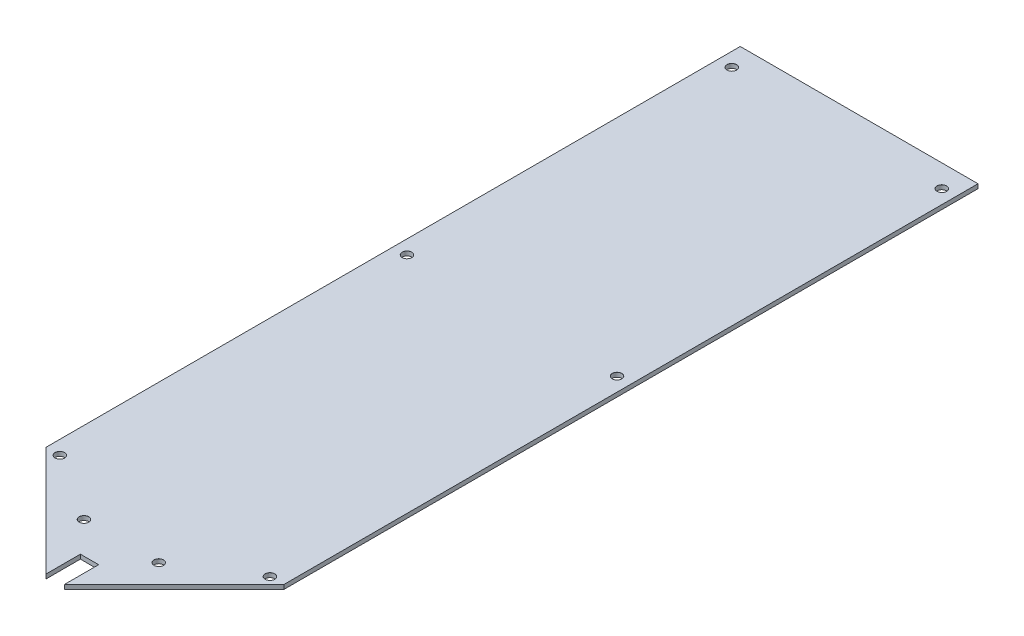
from build123d import *

# Parameters (mm, degrees)
BOSS_EXTRUDE1_DEPTH            = 3
M6_CLEARANCE_HOLE1_D           = 6.6
M6_CLEARANCE_HOLE1_DEPTH       = 12
M6_CLEARANCE_HOLE1_CSINK_D     = 6.65
M6_CLEARANCE_HOLE1_CSINK_ANGLE = 90
M6_CLEARANCE_HOLE1_TIP         = 1.982840043


with BuildPart() as part:
    # Sketch1 → Boss-Extrude1 (new body)
    with BuildSketch(Plane(origin=(0, 0, 0), x_dir=(1, 0, 0), z_dir=(0, 1, 0))):
        Polygon((6.35, 6.35), (82.7, 82.7), (82.7, 565.66051224), (-82.7, 565.66051224), (-82.7, 82.7), (-6.35, 6.35), (-6.35, 30.27243444), (6.35, 30.27243444), align=None)
    extrude(amount=-BOSS_EXTRUDE1_DEPTH)

    # M6 Clearance Hole1
    with Locations(Plane(origin=(-73.056682922, 0, -550.13126836), x_dir=(0, 0, 1), z_dir=(0, 1, 0))):
        with Locations((0, 0), (0, 146.113365844), (225.95101224, 0), (225.95101224, 146.113365844), (467.43126836, 146.113365844), (467.43126836, 0), (497.696436729, 47.041768684), (497.696436729, 99.07159716)):
            CounterSinkHole(M6_CLEARANCE_HOLE1_D / 2, M6_CLEARANCE_HOLE1_CSINK_D / 2, depth=M6_CLEARANCE_HOLE1_DEPTH, counter_sink_angle=M6_CLEARANCE_HOLE1_CSINK_ANGLE)
            with Locations((0, 0, -(M6_CLEARANCE_HOLE1_DEPTH + M6_CLEARANCE_HOLE1_TIP / 2))):  # 118° drill point
                Cone(0, M6_CLEARANCE_HOLE1_D / 2, M6_CLEARANCE_HOLE1_TIP, mode=Mode.SUBTRACT)


solid = part.part
